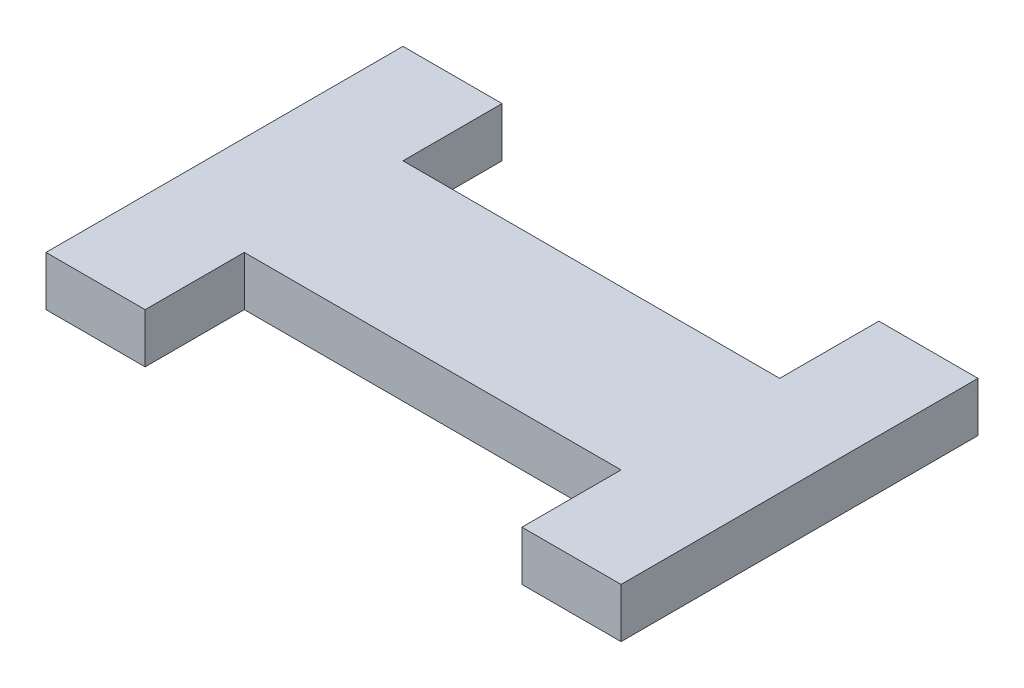
from build123d import *

# Parameters (mm, degrees)
SKETCH1_W           = 36.83
SKETCH1_H           = 22.86
BOSS_EXTRUDE1_DEPTH = 3.175
SKETCH2_W           = 24.13
SKETCH2_H           = 6.35
CUT_EXTRUDE1_DEPTH  = 22.905199155


with BuildPart() as part:
    # Sketch1 → Boss-Extrude1 (new body)
    with BuildSketch(Plane(origin=(0, 0, 0), x_dir=(1, 0, 0), z_dir=(0, 1, 0))):
        Rectangle(SKETCH1_W, SKETCH1_H)
    extrude(amount=BOSS_EXTRUDE1_DEPTH)

    # Sketch2 → Cut-Extrude1 (cut, through all)
    with BuildSketch(Plane(origin=(0, 3.175, 0), x_dir=(1, 0, 0), z_dir=(0, 1, 0))):
        with Locations((0, 8.255)):
            Rectangle(SKETCH2_W, SKETCH2_H)
        with Locations((0, -8.255)):
            Rectangle(SKETCH2_W, SKETCH2_H)
    extrude(amount=-CUT_EXTRUDE1_DEPTH, mode=Mode.SUBTRACT)


solid = part.part
